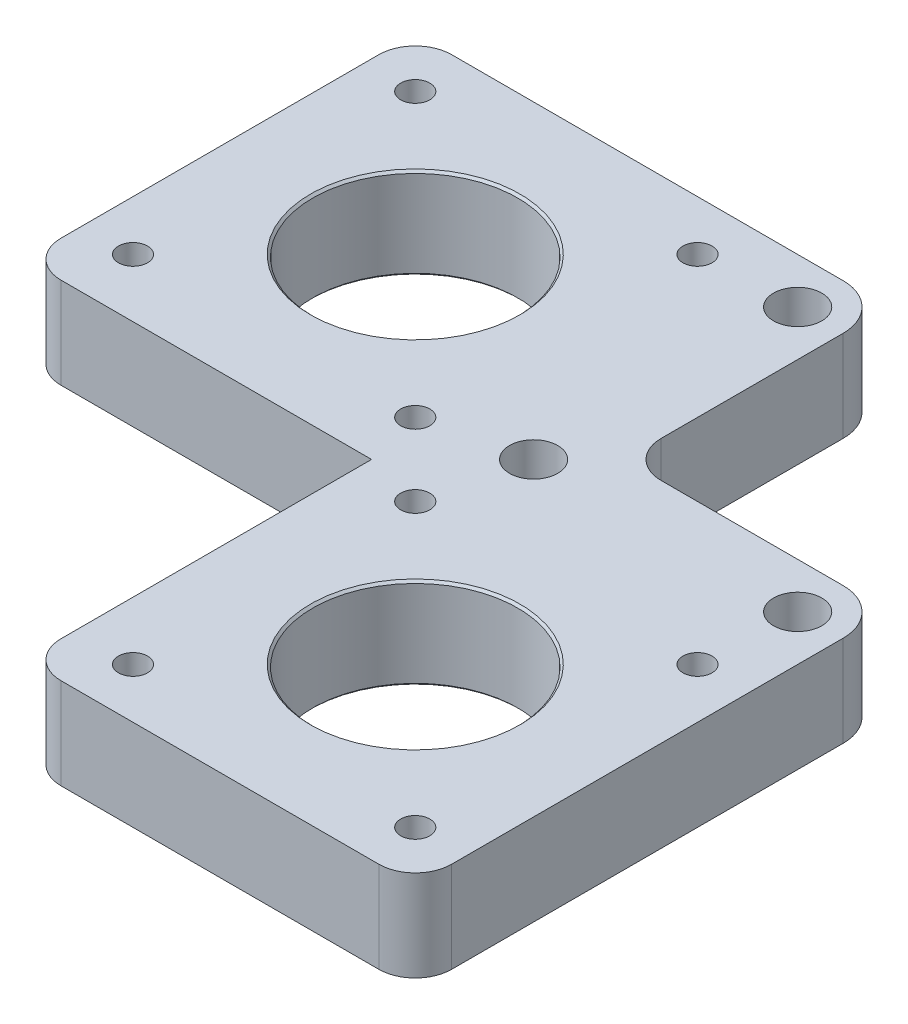
from build123d import *

# Parameters (mm, degrees)
BOSS_EXTRUDE1_DEPTH                  = 10
F_22_5_22_5_DIAMETER_HOLE1_D         = 22.5
CBORE_FOR_M3_SHCS1_D                 = 3.2
CBORE_FOR_M3_SHCS1_CBORE_D           = 6.5
CBORE_FOR_M3_SHCS1_CBORE_DEPTH       = 3
M5_CLEARANCE_HOLE1_D                 = 5.3
TAP_DRILL_FOR_M5X0_8_TAP1_AT_2_COUNT = 2
TAP_DRILL_FOR_M5X0_8_TAP1_AT_2_PITCH = 13.75
BOSS_EXTRUDE2_DEPTH                  = 10
FILLET2_R                            = 4
FILLET3_R                            = 5
CHAMFER1_SIZE                        = 0.25


with BuildPart() as part:
    # Sketch1 → Boss-Extrude1 (new body)
    with BuildSketch(Plane(origin=(0, 0, 0), x_dir=(1, 0, 0), z_dir=(0, 1, 0))):
        Polygon((60, -21), (60, 31), (31, 31), (31, 60), (-21, 60), (-21, 18), (18, 18), (18, -21), align=None)
    extrude(amount=BOSS_EXTRUDE1_DEPTH)

    # Ø22.5 (22.5) Diameter Hole1 (through all)
    with Locations(Plane(origin=(0, 10, 0), x_dir=(1, 0, 0), z_dir=(0, 1, 0))):
        with Locations((0, 39), (39, 0)):
            Hole(F_22_5_22_5_DIAMETER_HOLE1_D / 2)

    # CBORE for M3 SHCS1 (through all)
    with Locations(Plane(origin=(0, 0, 0), x_dir=(-1, 0, 0), z_dir=(0, -1, 0))):
        with Locations((-54.5, 15.5), (-23.5, 15.5), (-23.5, -15.5), (-54.5, -15.5), (-15.5, 54.5), (-15.5, 23.5), (15.5, 23.5), (15.5, 54.5)):
            CounterBoreHole(CBORE_FOR_M3_SHCS1_D / 2, CBORE_FOR_M3_SHCS1_CBORE_D / 2, CBORE_FOR_M3_SHCS1_CBORE_DEPTH)

    # M5 Clearance Hole1 (through all)
    with Locations(Plane(origin=(0, 10, 0), x_dir=(1, 0, 0), z_dir=(0, 1, 0))):
        with Locations((26, 55), (26, 26), (55, 26)):
            Hole(M5_CLEARANCE_HOLE1_D / 2)

    # Sketch15 → Tap Drill for M5x0.8 Tap1 (revolve, cut)
    with BuildSketch(Plane(origin=(5, 5, -18), x_dir=(0, -1, 0), z_dir=(1, 0, 0))):
        Polygon((0, 0), (0, 9.2618073), (2.1, 8), (2.1, 0), align=None)
    tap_drill_for_m5x0_8_tap1 = revolve(axis=Axis((5, 5, -11.65), (0, 0, -1)), mode=Mode.SUBTRACT)

    # Tap Drill for M5x0.8 Tap1 at 2: Tap Drill for M5x0.8 Tap1 ×2
    with Locations(*[(-i * TAP_DRILL_FOR_M5X0_8_TAP1_AT_2_PITCH, 0, 0) for i in range(1, TAP_DRILL_FOR_M5X0_8_TAP1_AT_2_COUNT)]):
        add(tap_drill_for_m5x0_8_tap1, mode=Mode.SUBTRACT)

    # Mirror1: Tap Drill for M5x0.8 Tap1 across plane
    add(tap_drill_for_m5x0_8_tap1.mirror(Plane(origin=(0, 0, 0), x_dir=(-0.7071067811865477, 0, 0.7071067811865474), z_dir=(0.7071067811865476, 0, 0.7071067811865476))), mode=Mode.SUBTRACT)

    # Mirror1 copy 1 sketch → Mirror1 copy 1 (revolve, cut)
    with BuildSketch(Plane(origin=(18, 5, 8.75), x_dir=(0, -1, 0), z_dir=(0, 0, -1))):
        Polygon((0, 0), (0, -9.2618073), (2.1, -8), (2.1, 0), align=None)
    revolve(axis=Axis((11.65, 5, 8.75), (-1, 0, 0)), mode=Mode.SUBTRACT)

    # Sketch16 → Boss-Extrude2 (add)
    with BuildSketch(Plane(origin=(0, 10, 0), x_dir=(1, 0, 0), z_dir=(0, 1, 0))):
        Polygon((17.1, 17.1), (-21, 17.1), (-21, 18), (18, 18), (18, -21), (17.1, -21), align=None)
    extrude(amount=-BOSS_EXTRUDE2_DEPTH)

    # Fillet2
    fillet2_edges = [part.edges().sort_by_distance(p)[0] for p in [
        (17.1, 5, 21),
        (-21, 5, -17.1),
        (-21, 5, -60),
        (31, 5, -31),
        (60, 5, 21),
    ]]
    fillet(fillet2_edges, radius=FILLET2_R)

    # Fillet3
    fillet3_edges = [part.edges().sort_by_distance(p)[0] for p in [
        (31, 5, -60),
        (60, 5, -31),
    ]]
    fillet(fillet3_edges, radius=FILLET3_R)

    # Chamfer1
    chamfer1_edges = [part.edges().sort_by_distance(p)[0] for p in [
        (50.25, 10, 0),
        (50.25, 0, 0),
        (11.25, 10, -39),
        (11.25, 0, -39),
    ]]
    chamfer(chamfer1_edges, length=CHAMFER1_SIZE)


solid = part.part
